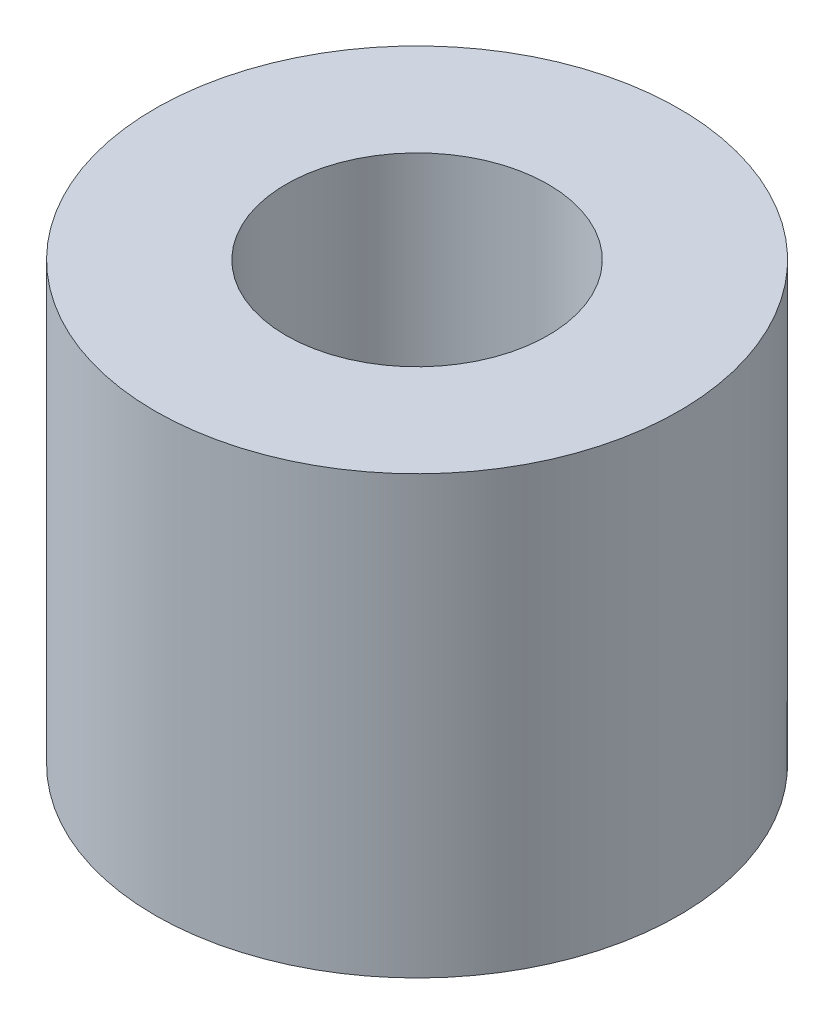
from build123d import *

# Parameters (mm, degrees)
ESBO_O1_R                = 3
ESBO_O1_R_2              = 1.5
RESSALTO_EXTRUS_O1_DEPTH = 5


with BuildPart() as part:
    # Esboço1 → Ressalto-extrusão1 (new body)
    with BuildSketch(Plane(origin=(0, 0, 0), x_dir=(1, 0, 0), z_dir=(0, 1, 0))):
        with Locations(Location((0, 0, 0), (0, 0, 270))):
            Circle(ESBO_O1_R)
        with Locations(Location((0, 0, 0), (0, 0, 270))):
            Circle(ESBO_O1_R_2, mode=Mode.SUBTRACT)
    extrude(amount=RESSALTO_EXTRUS_O1_DEPTH)


solid = part.part
